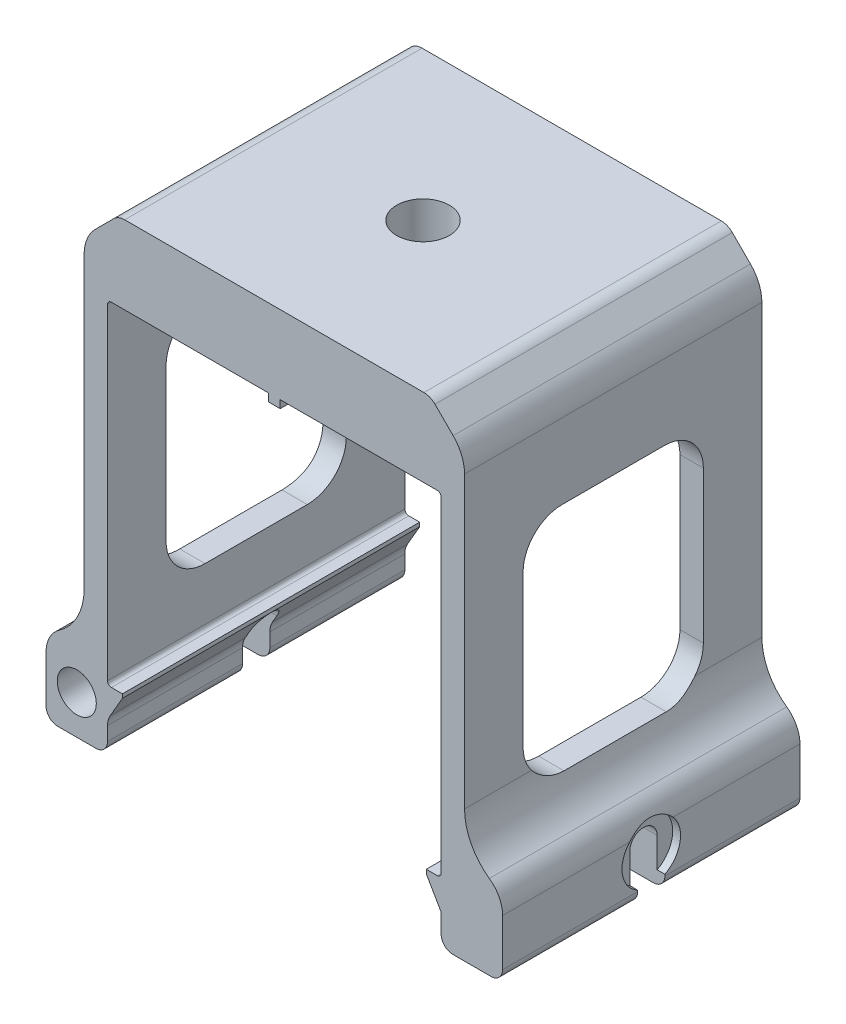
from build123d import *

# Parameters (mm, degrees)
BOSS_EXTRUDE1_DEPTH     = 38.1
SKETCH4_R               = 5
CUT_EXTRUDE2_DEPTH      = 147.798126691
FILLET1_R               = 1
FILLET2_R               = 4
BOSS_EXTRUDE5_START     = -76.2
BOSS_EXTRUDE5_DEPTH     = 76.2
SKETCH9_R               = 7.5
CUT_EXTRUDE3_DEPTH      = 2
SKETCH10_W              = 3
SKETCH10_H              = 76.2
BOSS_EXTRUDE4_DEPTH     = 2
CUT_EXTRUDE1_DEPTH      = 166.715448911
CUT_EXTRUDE8_DEPTH      = 166.715448911
CUT_EXTRUDE10_DEPTH     = 147.798126783
F_5_8_11_TAPPED_HOLE1_D = 13.49248
FILLET3_R               = 10


with BuildPart() as part:
    # Sketch1 → Boss-Extrude1 (new, symmetric)
    with BuildSketch(Plane.XY):
        with BuildLine():
            Line((-42.75, 91), (42.75, 91))
            Line((42.75, 91), (42.75, 6.5))
            ThreePointArc((42.75, 6.5), (42.457106781, 5.792893219), (41.75, 5.5))
            Line((41.75, 5.5), (38.933657049, 5.5))
            Line((38.933657049, 5.5), (38.933657049, 4.5))
            Line((38.933657049, 4.5), (42.616025404, -1.878049083))
            ThreePointArc((42.616025404, -1.878049083), (42.715925826, -2.119230038), (42.75, -2.378049083))
            Line((42.75, -2.378049083), (42.75, -7))
            ThreePointArc((42.75, -7), (43.628679656, -9.121320344), (45.75, -10))
            Line((45.75, -10), (55.5, -10))
            ThreePointArc((55.5, -10), (57.621320344, -9.121320344), (58.5, -7))
            Line((58.5, -7), (58.5, 92.5))
            Line((58.5, 92.5), (40, 111))
            Line((40, 111), (-40, 111))
            Line((-40, 111), (-58.5, 92.5))
            Line((-58.5, 92.5), (-58.5, 0))
            ThreePointArc((-58.5, 0), (-52.66319998, -7.606665882), (-43.805049945, -3.9375))
            Line((-43.805049945, -3.9375), (-38.933657049, 4.5))
            Line((-38.933657049, 4.5), (-38.933657049, 5.5))
            Line((-38.933657049, 5.5), (-41.75, 5.5))
            ThreePointArc((-41.75, 5.5), (-42.457106781, 5.792893219), (-42.75, 6.5))
            Line((-42.75, 6.5), (-42.75, 91))
        make_face()
    extrude(amount=BOSS_EXTRUDE1_DEPTH, both=True)

    # Sketch4 → Cut-Extrude2 (cut, through all)
    with BuildSketch(Plane.XY.offset(38.1)):
        with Locations((-50.625, 0)):
            Circle(SKETCH4_R)
    extrude(amount=-CUT_EXTRUDE2_DEPTH, mode=Mode.SUBTRACT)

    # Fillet1
    fillet1_edges = [part.edges().sort_by_distance(p)[0] for p in [
        (42.75, 91, 0),
        (-42.75, 91, 0),
    ]]
    fillet(fillet1_edges, radius=FILLET1_R)

    # Fillet2
    fillet2_edges = [part.edges().sort_by_distance(p)[0] for p in [
        (-58.5, 92.5, 0),
        (-40, 111, 0),
        (40, 111, 0),
        (58.5, 92.5, 0),
    ]]
    fillet(fillet2_edges, radius=FILLET2_R)

    # Sketch14 → Boss-Extrude5 (add)
    with BuildSketch(Plane(origin=(0, 0, -38.1), x_dir=(-1, 0, 0), z_dir=(0, 0, -1)).offset(BOSS_EXTRUDE5_START)):
        with BuildLine():
            Line((45.75, -10), (55.5, -10))
            ThreePointArc((55.5, -10), (57.621320344, -9.121320344), (58.5, -7))
            Line((58.5, -7), (58.5, 0))
            ThreePointArc((58.5, 0), (52.66319998, -7.606665882), (43.805049945, -3.9375))
            Line((43.805049945, -3.9375), (42.080127019, -0.949845853))
            ThreePointArc((42.080127019, -0.949845853), (42.579629131, -2.155750627), (42.75, -3.449845853))
            Line((42.75, -3.449845853), (42.75, -7))
            ThreePointArc((42.75, -7), (43.628679656, -9.121320344), (45.75, -10))
        make_face()
    extrude(amount=BOSS_EXTRUDE5_DEPTH)

    # Sketch9 → Cut-Extrude3 (cut)
    with BuildSketch(Plane(origin=(58.5, 0, 0), x_dir=(0, 0, -1), z_dir=(1, 0, 0))):
        with Locations(Location((0, 0, 0), (0, 0, 90))):
            Circle(SKETCH9_R)
    extrude(amount=-CUT_EXTRUDE3_DEPTH, mode=Mode.SUBTRACT)

    # Sketch10 → Boss-Extrude4 (add)
    with BuildSketch(Plane.XZ.offset(-91)):
        Rectangle(SKETCH10_W, SKETCH10_H)
    extrude(amount=BOSS_EXTRUDE4_DEPTH)

    # Sketch3 → Cut-Extrude1 (cut, through all)
    with BuildSketch(Plane(origin=(58.5, 0, 0), x_dir=(0, 0, -1), z_dir=(1, 0, 0))):
        with BuildLine():
            Line((3.5, 1), (3.5, -10))
            ThreePointArc((3.5, -10), (0, -13.5), (-3.5, -10))
            Line((-3.5, -10), (-3.5, 1))
            ThreePointArc((-3.5, 1), (0, 4.5), (3.5, 1))
        make_face()
    extrude(amount=-CUT_EXTRUDE1_DEPTH, mode=Mode.SUBTRACT)

    # Sketch18 → Cut-Extrude8 (cut, through all)
    with BuildSketch(Plane.ZY.offset(58.5)):
        with BuildLine():
            Line((-13.1, 78.843145751), (13.1, 78.843145751))
            ThreePointArc((13.1, 78.843145751), (20.171067812, 75.914213562), (23.1, 68.843145751))
            Line((23.1, 68.843145751), (23.1, 30))
            ThreePointArc((23.1, 30), (20.171067812, 22.928932188), (13.1, 20))
            Line((13.1, 20), (-13.1, 20))
            ThreePointArc((-13.1, 20), (-20.171067812, 22.928932188), (-23.1, 30))
            Line((-23.1, 30), (-23.1, 68.843145751))
            ThreePointArc((-23.1, 68.843145751), (-20.171067812, 75.914213562), (-13.1, 78.843145751))
        make_face()
    extrude(amount=-CUT_EXTRUDE8_DEPTH, mode=Mode.SUBTRACT)

    # Sketch22 → Cut-Extrude10 (cut, through all)
    with BuildSketch(Plane(origin=(0, 0, -38.1), x_dir=(-1, 0, 0), z_dir=(0, 0, -1))):
        with BuildLine():
            Line((48.75, 102.25), (48.75, 23.799933511))
            ThreePointArc((48.75, 23.799933511), (50.434228051, 16.894123103), (55.108695652, 11.539107308))
            ThreePointArc((55.108695652, 11.539107308), (57.60174504, 8.683098884), (58.5, 5))
            Line((58.5, 5), (58.5, 90.843145751))
            ThreePointArc((58.5, 90.843145751), (58.19551813, 92.37387948), (57.328427125, 93.671572875))
            Line((57.328427125, 93.671572875), (48.75, 102.25))
        make_face()
        with BuildLine():
            Line((-48.75, 23.799933511), (-48.75, 102.25))
            Line((-48.75, 102.25), (-57.328427125, 93.671572875))
            ThreePointArc((-57.328427125, 93.671572875), (-58.19551813, 92.37387948), (-58.5, 90.843145751))
            Line((-58.5, 90.843145751), (-58.5, 5))
            ThreePointArc((-58.5, 5), (-57.60174504, 8.683098884), (-55.108695652, 11.539107308))
            ThreePointArc((-55.108695652, 11.539107308), (-50.434228051, 16.894123103), (-48.75, 23.799933511))
        make_face()
    extrude(amount=-CUT_EXTRUDE10_DEPTH, mode=Mode.SUBTRACT)

    # 5/8-11 Tapped Hole1 (through all)
    with Locations(Plane(origin=(0, 111, 0), x_dir=(1, 0, 0), z_dir=(0, 1, 0))):
        with Locations((0, 0)):
            Hole(F_5_8_11_TAPPED_HOLE1_D / 2)

    # Fillet3
    fillet3_edges = [part.edges().sort_by_distance(p)[0] for p in [
        (-48.75, 102.25, 0),
        (48.75, 102.25, 0),
    ]]
    fillet(fillet3_edges, radius=FILLET3_R)


solid = part.part
